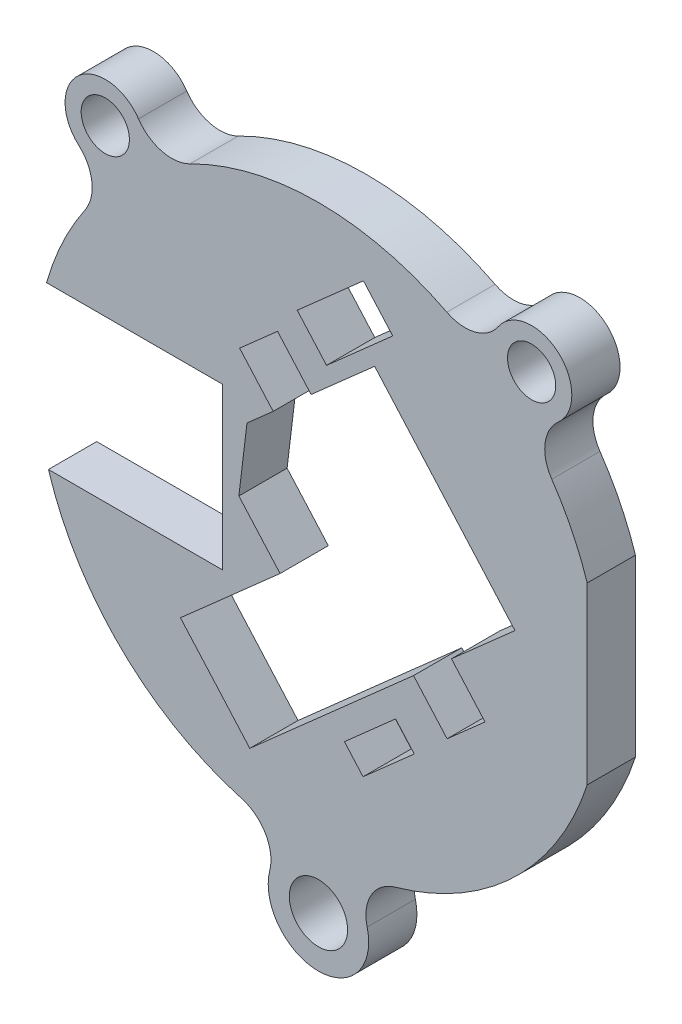
from build123d import *
from build123d.topology import SkipClean

# Parameters (mm, degrees)
SKETCH1_R           = 1.4224
BOSS_EXTRUDE1_DEPTH = 3.048
CUT_EXTRUDE3_DEPTH  = 31.684629768
CUT_EXTRUDE4_DEPTH  = 31.684629768
SKETCH4_R           = 1.1049
BOSS_EXTRUDE2_DEPTH = 3.048
SKETCH4_3_R         = 1.1049
CUT_EXTRUDE5_DEPTH  = 31.619000053
CUT_EXTRUDE10_DEPTH = 29.661642774
BOSS_EXTRUDE3_START = -3.048
BOSS_EXTRUDE3_DEPTH = 3.048
SKETCH7_W           = 1.0287
SKETCH7_H           = 10.16
CUT_EXTRUDE11_DEPTH = 30.194889838
SKETCH8_R           = 23.497624495
SKETCH8_R_2         = 17.859965052
CUT_EXTRUDE12_DEPTH = 30.194889838
BOSS_EXTRUDE4_START = -3.048
SKETCH9_R           = 2.54
SKETCH9_R_2         = 1.524
SKETCH9_R_3         = 3.175
SKETCH9_R_4         = 1.8415
BOSS_EXTRUDE4_DEPTH = 3.048
CUT_EXTRUDE14_DEPTH = 30.843054222


with BuildPart() as part:
    # Sketch1 → Boss-Extrude1 (new body)
    with BuildSketch(Plane.XY):
        with BuildLine():
            Line((-5.027565338, -0.720652536), (-4.515281158, 3.5306))
            Line((-4.515281158, 3.5306), (-2.860140414, 4.994714494))
            Line((-2.860140414, 4.994714494), (-4.980602482, 7.391837931))
            Line((-4.980602482, 7.391837931), (-2.583479045, 9.5123))
            Line((-2.583479045, 9.5123), (-0.463016976, 7.115176563))
            Line((-0.463016976, 7.115176563), (11.876076152, 18.030166811))
            ThreePointArc((11.876076152, 18.030166811), (-16.886200405, -13.453041882), (20.228041911, 7.546815251))
            Line((20.228041911, 7.546815251), (8.405899773, -2.910887338))
            Line((8.405899773, -2.910887338), (10.526361842, -5.308010776))
            Line((10.526361842, -5.308010776), (8.129238404, -7.428472845))
            Line((8.129238404, -7.428472845), (6.008776335, -5.031349407))
            Line((6.008776335, -5.031349407), (4.353635591, -6.495463901))
            Line((4.353635591, -6.495463901), (1.815981702, -6.489359631))
            Line((1.815981702, -6.489359631), (-5.455454601, -12.9215711))
            Line((-5.455454601, -12.9215711), (-8.720293025, -9.230761998))
            Line((-8.720293025, -9.230761998), (-2.425370717, -3.662361234))
            Line((-2.425370717, -3.662361234), (-5.027565338, -0.720652536))
        make_face()
        with Locations(Location((0, 18.415, 0), (0, 0, 180))):
            Circle(SKETCH1_R, mode=Mode.SUBTRACT)
        with Locations(Location((0, -18.415, 0), (0, 0, 180))):
            Circle(SKETCH1_R, mode=Mode.SUBTRACT)
    extrude(amount=BOSS_EXTRUDE1_DEPTH)

    # Sketch2 → Cut-Extrude3 (cut, through all)
    with BuildSketch(Plane.XY.offset(3.048)):
        with BuildLine():
            Line((-7.084965338, 4.8768), (-21.031997569, 4.8768))
            ThreePointArc((-21.031997569, 4.8768), (-21.588987692, -0.209070373), (-20.933606898, -5.2832))
            Line((-20.933606898, -5.2832), (-7.084965338, -5.2832))
            Line((-7.084965338, -5.2832), (-7.084965338, 4.8768))
        make_face()
    extrude(amount=-CUT_EXTRUDE3_DEPTH, mode=Mode.SUBTRACT)

    # Sketch3 → Cut-Extrude4 (cut, through all)
    with BuildSketch(Plane(origin=(0, 0, 0), x_dir=(-1, 0, 0), z_dir=(0, 0, -1))):
        with BuildLine():
            Line((-20.871224203, -5.5245), (-16.984058744, -5.5245))
            Line((-16.984058744, -5.5245), (-16.984058744, 4.677232838))
            Line((-16.984058744, 4.677232838), (-20.228041911, 7.546815251))
            ThreePointArc((-20.228041911, 7.546815251), (-21.563910577, 1.061065789), (-20.871224203, -5.5245))
        make_face()
    extrude(amount=-CUT_EXTRUDE4_DEPTH, mode=Mode.SUBTRACT)

    # Sketch4 → Boss-Extrude2 (add)
    # profile 1 of 5: a face of its own
    with BuildSketch(Plane(origin=(0, 0, 0), x_dir=(-1, 0, 0), z_dir=(0, 0, -1))):
        with BuildLine():
            Line((-16.984058744, 5.5245), (-16.984058744, 4.677232838))
            Line((-16.984058744, 4.677232838), (-12.420130291, 0.640045174))
            Line((-12.420130291, 0.640045174), (-3.551213542, 10.666109075))
            Line((-3.551213542, 10.666109075), (-8.959431605, 15.450143591))
            ThreePointArc((-8.959431605, 15.450143591), (-11.076965007, 14.009967805), (-12.966760902, 12.28175327))
            Line((-12.966760902, 12.28175327), (-15.004080987, 13.83506338))
            ThreePointArc((-15.004080987, 13.83506338), (-17.674010029, 13.475162132), (-17.314108781, 10.80523309))
            Line((-17.314108781, 10.80523309), (-15.276788696, 9.25192298))
            ThreePointArc((-15.276788696, 9.25192298), (-16.237733521, 7.437362555), (-16.984058744, 5.5245))
        make_face()
        with Locations((-16.159094884, 12.320148235)):
            Circle(SKETCH4_R, mode=Mode.SUBTRACT)
    # profile 2 of 5: a face of its own
    with BuildSketch(Plane(origin=(0, 0, 0), x_dir=(-1, 0, 0), z_dir=(0, 0, -1))):
        with BuildLine():
            ThreePointArc((-1.288911844, -17.813395463), (-0.402766027, -17.855423019), (0.484373541, -17.853395586))
            Line((0.484373541, -17.853395586), (0.725034865, -19.638742704))
            ThreePointArc((0.725034865, -19.638742704), (0.955229003, -17.361074333), (-1.288911844, -17.813395463))
        make_face()
    # profile 3 of 5: a face of its own
    with BuildSketch(Plane(origin=(0, 0, 0), x_dir=(-1, 0, 0), z_dir=(0, 0, -1))):
        with BuildLine():
            ThreePointArc((4.327227494, -21.151907768), (2.884204284, -21.396482553), (1.427926458, -21.542727915))
            ThreePointArc((1.427926458, -21.542727915), (2.969033821, -22.025790864), (4.327227494, -21.151907768))
        make_face()
    # profile 4 of 5: a face of its own
    with BuildSketch(Plane(origin=(0, 0, 0), x_dir=(-1, 0, 0), z_dir=(0, 0, -1))):
        with BuildLine():
            ThreePointArc((1.288911844, 17.813395463), (0, 17.859965052), (-1.288911844, 17.813395463))
            ThreePointArc((-1.288911844, 17.813395463), (0, 16.9926), (1.288911844, 17.813395463))
        make_face()
    # profile 5 of 5: a face of its own
    with BuildSketch(Plane(origin=(0, 0, 0), x_dir=(-1, 0, 0), z_dir=(0, 0, -1))):
        with BuildLine():
            ThreePointArc((14.223312513, 16.242705475), (13.475162132, 17.674010029), (11.896845513, 18.016469323))
            ThreePointArc((11.896845513, 18.016469323), (13.0901575, 17.169038314), (14.223312513, 16.242705475))
        make_face()
    extrude(amount=-BOSS_EXTRUDE2_DEPTH)

    # Sketch4<3> → Cut-Extrude5 (cut, through all)
    with SkipClean():  # the faces are left unmerged after this step: merging them gives an invalid solid
        with BuildSketch(Plane(origin=(0, 0, 0), x_dir=(-1, 0, 0), z_dir=(0, 0, -1))):
            with BuildLine():
                ThreePointArc((-20.871224203, -5.5245), (-12.595886757, -17.534872021), (1.427926458, -21.542727915))
                ThreePointArc((1.427926458, -21.542727915), (1.026270462, -21.020335978), (0.826620277, -20.392354546))
                Line((0.826620277, -20.392354546), (0.725034865, -19.638742704))
                ThreePointArc((0.725034865, -19.638742704), (-0.955229003, -19.468925667), (-1.288911844, -17.813395463))
                ThreePointArc((-1.288911844, -17.813395463), (-11.010431484, -14.062316673), (-16.984058744, -5.5245))
                Line((-16.984058744, -5.5245), (-20.871224203, -5.5245))
            make_face()
            with BuildLine():
                ThreePointArc((4.602470139, -19.883377319), (4.576225926, -20.541808877), (4.327227494, -21.151907768))
                ThreePointArc((4.327227494, -21.151907768), (14.915810742, -15.609186074), (20.933606898, -5.2832))
                Line((20.933606898, -5.2832), (17.060660873, -5.2832))
                ThreePointArc((17.060660873, -5.2832), (12.247990597, -12.998656777), (4.260223404, -17.344418359))
                Line((4.260223404, -17.344418359), (4.602470139, -19.883377319))
            make_face()
            with BuildLine():
                Line((-11.876076152, 18.030166811), (-8.959431605, 15.450143591))
                ThreePointArc((-8.959431605, 15.450143591), (-5.258647708, 17.068244665), (-1.288911844, 17.813395463))
                ThreePointArc((-1.288911844, 17.813395463), (0, 19.8374), (1.288911844, 17.813395463))
                ThreePointArc((1.288911844, 17.813395463), (5.420875683, 17.017416329), (9.25192298, 15.276788696))
                Line((9.25192298, 15.276788696), (10.80523309, 17.314108781))
                ThreePointArc((10.80523309, 17.314108781), (11.28937197, 17.76113274), (11.896845513, 18.016469323))
                ThreePointArc((11.896845513, 18.016469323), (0.01243973, 21.589996416), (-11.876076152, 18.030166811))
            make_face()
            with BuildLine():
                Line((13.83506338, 15.004080987), (12.28175327, 12.966760902))
                ThreePointArc((12.28175327, 12.966760902), (15.276744775, 9.251995502), (17.181244816, 4.8768))
                Line((17.181244816, 4.8768), (21.031997569, 4.8768))
                ThreePointArc((21.031997569, 4.8768), (18.521073783, 11.09495047), (14.223312513, 16.242705475))
                ThreePointArc((14.223312513, 16.242705475), (14.13793931, 15.589304916), (13.83506338, 15.004080987))
            make_face()
            with Locations((12.320148235, 16.159094884)):
                Circle(SKETCH4_3_R)
            with Locations((2.714545208, -20.137865932)):
                Circle(SKETCH4_3_R)
        extrude(amount=-CUT_EXTRUDE5_DEPTH, mode=Mode.SUBTRACT)

    # Sketch5 → Cut-Extrude10 (cut, through all)
    with SkipClean():  # the faces are left unmerged after this step: merging them gives an invalid solid
        with BuildSketch(Plane.XY.offset(3.048)):
            Polygon((4.353635591, -6.495463901), (-4.338426069, -14.184340812), (-5.455454601, -12.9215711), (1.815981702, -6.489359631), align=None)
        extrude(amount=-CUT_EXTRUDE10_DEPTH, mode=Mode.SUBTRACT)

    # Sketch6 → Boss-Extrude3 (add)
    with SkipClean():  # the faces are left unmerged after this step: merging them gives an invalid solid
        with BuildSketch(Plane.XY.offset(3.048).offset(BOSS_EXTRUDE3_START)):
            with BuildLine():
                ThreePointArc((-9.25192298, 15.276788696), (-9.087308864, 15.375277861), (-8.92164642, 15.471993305))
                Line((-8.92164642, 15.471993305), (-8.948939951, 15.507791475))
                Line((-8.948939951, 15.507791475), (-10.502250061, 17.54511156))
                ThreePointArc((-10.502250061, 17.54511156), (-13.706164911, 17.976993058), (-14.138046409, 14.773078207))
                Line((-14.138046409, 14.773078207), (-12.584736299, 12.735758122))
                Line((-12.584736299, 12.735758122), (-12.557442768, 12.699959952))
                ThreePointArc((-12.557442768, 12.699959952), (-12.420314434, 12.83410071), (-12.28175327, 12.966760902))
                Line((-12.28175327, 12.966760902), (-13.83506338, 15.004080987))
                ThreePointArc((-13.83506338, 15.004080987), (-13.475162132, 17.674010029), (-10.80523309, 17.314108781))
                Line((-10.80523309, 17.314108781), (-9.25192298, 15.276788696))
            make_face()
            with BuildLine():
                Line((-0.106788555, -17.904293309), (-0.100774867, -17.859680739))
                ThreePointArc((-0.100774867, -17.859680739), (-0.292591081, -17.857568203), (-0.484373541, -17.853395586))
                Line((-0.484373541, -17.853395586), (-0.826620277, -20.392354546))
                ThreePointArc((-0.826620277, -20.392354546), (-2.969033821, -22.025790864), (-4.602470139, -19.883377319))
                Line((-4.602470139, -19.883377319), (-4.260223404, -17.344418359))
                ThreePointArc((-4.260223404, -17.344418359), (-4.446265517, -17.297660958), (-4.631794702, -17.248908067))
                Line((-4.631794702, -17.248908067), (-4.63780839, -17.293520637))
                Line((-4.63780839, -17.293520637), (-4.980055125, -19.832479597))
                ThreePointArc((-4.980055125, -19.832479597), (-3.019931544, -22.40337585), (-0.449035291, -20.443252268))
                Line((-0.449035291, -20.443252268), (-0.106788555, -17.904293309))
            make_face()
            with BuildLine():
                ThreePointArc((15.004080987, 13.83506338), (17.674010029, 13.475162132), (17.314108781, 10.80523309))
                Line((17.314108781, 10.80523309), (15.276788696, 9.25192298))
                ThreePointArc((15.276788696, 9.25192298), (15.375277861, 9.087308864), (15.471993305, 8.92164642))
                Line((15.471993305, 8.92164642), (17.54511156, 10.502250061))
                ThreePointArc((17.54511156, 10.502250061), (17.976993058, 13.706164911), (14.773078207, 14.138046409))
                Line((14.773078207, 14.138046409), (12.699959952, 12.557442768))
                ThreePointArc((12.699959952, 12.557442768), (12.83410071, 12.420314434), (12.966760902, 12.28175327))
                Line((12.966760902, 12.28175327), (15.004080987, 13.83506338))
            make_face()
        extrude(amount=BOSS_EXTRUDE3_DEPTH)

    # Sketch7 → Cut-Extrude11 (cut, through all)
    with SkipClean():  # the faces are left unmerged after this step: merging them gives an invalid solid
        with BuildSketch(Plane(origin=(0, 0, 0), x_dir=(-1, 0, 0), z_dir=(0, 0, -1))):
            with Locations((6.570615338, -0.2032)):
                Rectangle(SKETCH7_W, SKETCH7_H)
        extrude(amount=-CUT_EXTRUDE11_DEPTH, mode=Mode.SUBTRACT)

    # Sketch8 → Cut-Extrude12 (cut, through all)
    with SkipClean():  # the faces are left unmerged after this step: merging them gives an invalid solid
        with BuildSketch(Plane.XY.offset(3.048)):
            Circle(SKETCH8_R)
            Circle(SKETCH8_R_2, mode=Mode.SUBTRACT)
        extrude(amount=-CUT_EXTRUDE12_DEPTH, mode=Mode.SUBTRACT)

    # Sketch9 → Boss-Extrude4 (add)
    # profile 1 of 9: a face of its own
    with SkipClean():  # the faces are left unmerged after this step: merging them gives an invalid solid
        with BuildSketch(Plane.XY.offset(3.048).offset(BOSS_EXTRUDE4_START)):
            with BuildLine():
                ThreePointArc((14.741706397, 10.082680407), (14.317457477, 11.828509859), (15.154420991, 13.418289622))
                ThreePointArc((15.154420991, 13.418289622), (13.475000191, 12.779968852), (11.793381211, 13.412475957))
                ThreePointArc((11.793381211, 13.412475957), (13.371596882, 11.839710659), (14.741706397, 10.082680407))
            make_face()
        # profile 2 of 9: a face of its own
        with BuildSketch(Plane.XY.offset(3.048).offset(BOSS_EXTRUDE4_START)):
            with Locations((13.470606702, 15.319965052)):
                Circle(SKETCH9_R)
            with Locations((13.470606702, 15.319965052)):
                Circle(SKETCH9_R_2, mode=Mode.SUBTRACT)
        # profile 3 of 9: a face of its own
        with BuildSketch(Plane.XY.offset(3.048).offset(BOSS_EXTRUDE4_START)):
            with BuildLine():
                ThreePointArc((11.793381211, 13.412475957), (10.950922895, 14.999350783), (11.369129659, 16.746637488))
                ThreePointArc((11.369129659, 16.746637488), (9.899497892, 15.713153035), (8.113737041, 15.910550679))
                ThreePointArc((8.113737041, 15.910550679), (10.031621684, 14.776498844), (11.793381211, 13.412475957))
            make_face()
        # profile 4 of 9: a face of its own
        with BuildSketch(Plane.XY.offset(3.048).offset(BOSS_EXTRUDE4_START)):
            with BuildLine():
                ThreePointArc((-14.741706395, 10.08268041), (-13.371596897, 11.839710643), (-11.793381246, 13.412475926))
                ThreePointArc((-11.793381246, 13.412475926), (-13.475000239, 12.779968852), (-15.154421029, 13.418289656))
                ThreePointArc((-15.154421029, 13.418289656), (-14.522151553, 12.559377803), (-14.29823536, 11.516614264))
                ThreePointArc((-14.29823536, 11.516614264), (-14.411634489, 10.766142269), (-14.741706395, 10.08268041))
            make_face()
        # profile 5 of 9: a face of its own
        with BuildSketch(Plane.XY.offset(3.048).offset(BOSS_EXTRUDE4_START)):
            with Locations((-13.470606702, 15.319965052)):
                Circle(SKETCH9_R)
            with Locations((-13.470606702, 15.319965052)):
                Circle(SKETCH9_R_2, mode=Mode.SUBTRACT)
        # profile 6 of 9: a face of its own
        with BuildSketch(Plane.XY.offset(3.048).offset(BOSS_EXTRUDE4_START)):
            with BuildLine():
                ThreePointArc((-11.793381246, 13.412475926), (-10.031621687, 14.776498841), (-8.113737006, 15.910550697))
                ThreePointArc((-8.113737006, 15.910550697), (-9.899497839, 15.713153021), (-11.36912962, 16.74663743))
                ThreePointArc((-11.36912962, 16.74663743), (-11.042711339, 16.066238532), (-10.930606702, 15.319965052))
                ThreePointArc((-10.930606702, 15.319965052), (-11.15633007, 14.27319685), (-11.793381246, 13.412475926))
            make_face()
        # profile 7 of 9: a face of its own
        with BuildSketch(Plane.XY.offset(3.048).offset(BOSS_EXTRUDE4_START)):
            with Locations((0, -21.034965052)):
                Circle(SKETCH9_R_3)
            with Locations((0, -21.034965052)):
                Circle(SKETCH9_R_4, mode=Mode.SUBTRACT)
        # profile 8 of 9: a face of its own
        with BuildSketch(Plane.XY.offset(3.048).offset(BOSS_EXTRUDE4_START)):
            with BuildLine():
                ThreePointArc((-3.07801145, -20.256202884), (-1.95039164, -18.52965121), (5e-09, -17.859965052))
                ThreePointArc((5e-09, -17.859965052), (-2.448407595, -17.691343983), (-4.850582953, -17.188664773))
                ThreePointArc((-4.850582953, -17.188664773), (-3.515107511, -18.100319075), (-3.000420852, -19.633194109))
                ThreePointArc((-3.000420852, -19.633194109), (-3.019893142, -19.947105018), (-3.07801145, -20.256202884))
            make_face()
        # profile 9 of 9: a face of its own
        with BuildSketch(Plane.XY.offset(3.048).offset(BOSS_EXTRUDE4_START)):
            with BuildLine():
                ThreePointArc((3.078011454, -20.2562029), (3.341190684, -18.362372853), (4.850582919, -17.188664783))
                ThreePointArc((4.850582919, -17.188664783), (2.448407582, -17.691343985), (5e-09, -17.859965052))
                ThreePointArc((5e-09, -17.859965052), (1.95039165, -18.529651218), (3.078011454, -20.2562029))
            make_face()
        extrude(amount=BOSS_EXTRUDE4_DEPTH)

    # Sketch11 → Cut-Extrude14 (cut, through all)
    with SkipClean():  # the faces are left unmerged after this step: merging them gives an invalid solid
        with BuildSketch(Plane.XY.offset(3.048)):
            Polygon((-1.341002823, 11.289608099), (0.510194221, 9.196881289), (4.695647842, 12.899275377), (2.844450797, 14.992002188), align=None)
            Polygon((6.053340658, -9.298694678), (2.819126496, -12.159635565), (1.641092014, -10.827900322), (4.875306175, -7.966959435), align=None)
        extrude(amount=-CUT_EXTRUDE14_DEPTH, mode=Mode.SUBTRACT)


solid = part.part
